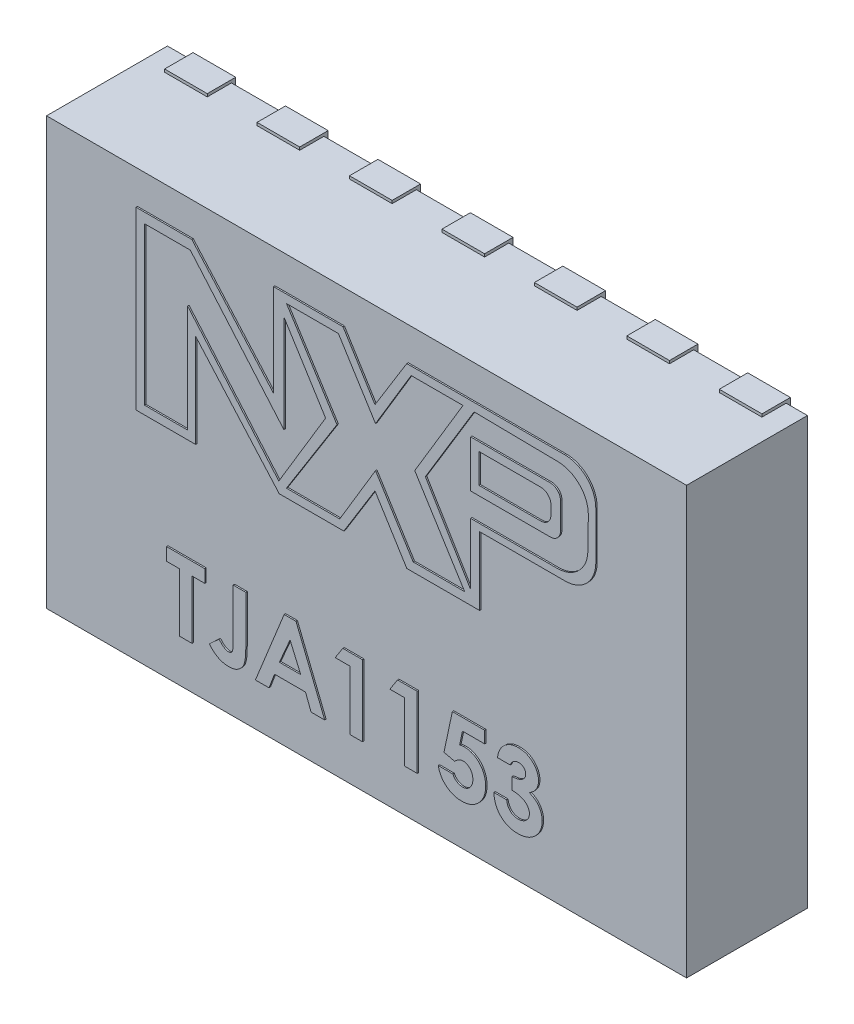
from build123d import *

# Parameters (mm, degrees)
SKETCH1_W           = 4.5
SKETCH1_H           = 3
BOSS_EXTRUDE1_DEPTH = 0.85
SKETCH2_W           = 4.2
SKETCH2_H           = 1.6
SKETCH2_W_2         = 0.3
SKETCH2_H_2         = 0.557287179
BOSS_EXTRUDE2_DEPTH = 0.03
SKETCH3_W           = 5.542428218
SKETCH3_H           = 0.402549931
SKETCH3_W_2         = 5.108551145
SKETCH3_H_2         = 0.537427481
CUT_EXTRUDE1_DEPTH  = 2.03
SKETCH4_W           = 0.3
SKETCH4_H           = 0.2
BOSS_EXTRUDE3_DEPTH = 0.02
BOSS_EXTRUDE4_DEPTH = 0.01
BOSS_EXTRUDE5_DEPTH = 0.01


with BuildPart() as part:
    # Sketch1 → Boss-Extrude1 (new body)
    with BuildSketch(Plane.XY):
        Rectangle(SKETCH1_W, SKETCH1_H)
    extrude(amount=BOSS_EXTRUDE1_DEPTH)

    # Sketch2 → Boss-Extrude2 (add)
    with BuildSketch(Plane(origin=(0, 0, 0), x_dir=(-1, 0, 0), z_dir=(0, 0, -1))):
        Rectangle(SKETCH2_W, SKETCH2_H)
        with Locations((-1.95, 1.37864359)):
            Rectangle(SKETCH2_W_2, SKETCH2_H_2)
        with Locations((-1.3, 1.37864359)):
            Rectangle(SKETCH2_W_2, SKETCH2_H_2)
        with Locations((-0.65, 1.37864359)):
            Rectangle(SKETCH2_W_2, SKETCH2_H_2)
        with Locations((0, 1.37864359)):
            Rectangle(SKETCH2_W_2, SKETCH2_H_2)
        with Locations((0.65, 1.37864359)):
            Rectangle(SKETCH2_W_2, SKETCH2_H_2)
        with Locations((1.3, 1.37864359)):
            Rectangle(SKETCH2_W_2, SKETCH2_H_2)
        with Locations((1.95, 1.37864359)):
            Rectangle(SKETCH2_W_2, SKETCH2_H_2)
        with Locations((1.95, -1.37864359)):
            Rectangle(SKETCH2_W_2, SKETCH2_H_2)
        with Locations((1.3, -1.37864359)):
            Rectangle(SKETCH2_W_2, SKETCH2_H_2)
        with Locations((0.65, -1.37864359)):
            Rectangle(SKETCH2_W_2, SKETCH2_H_2)
        with Locations((0, -1.37864359)):
            Rectangle(SKETCH2_W_2, SKETCH2_H_2)
        with Locations((-0.65, -1.37864359)):
            Rectangle(SKETCH2_W_2, SKETCH2_H_2)
        with Locations((-1.3, -1.37864359)):
            Rectangle(SKETCH2_W_2, SKETCH2_H_2)
        with Locations((-1.95, -1.37864359)):
            Rectangle(SKETCH2_W_2, SKETCH2_H_2)
    extrude(amount=BOSS_EXTRUDE2_DEPTH)

    # Sketch3 → Cut-Extrude1 (cut)
    with BuildSketch(Plane.XY.offset(0.85)):
        with Locations((0.521214109, 1.701274966)):
            Rectangle(SKETCH3_W, SKETCH3_H)
        with Locations((0.304275573, -1.76871374)):
            Rectangle(SKETCH3_W_2, SKETCH3_H_2)
    extrude(amount=-CUT_EXTRUDE1_DEPTH, mode=Mode.SUBTRACT)

    # Sketch4 → Boss-Extrude3 (add)
    with BuildSketch(Plane.XZ.offset(1.5)):
        with Locations((-1.95, 0.07)):
            Rectangle(SKETCH4_W, SKETCH4_H)
        with Locations((-1.3, 0.07)):
            Rectangle(SKETCH4_W, SKETCH4_H)
        with Locations((-0.65, 0.07)):
            Rectangle(SKETCH4_W, SKETCH4_H)
        with Locations((0, 0.07)):
            Rectangle(SKETCH4_W, SKETCH4_H)
        with Locations((0.65, 0.07)):
            Rectangle(SKETCH4_W, SKETCH4_H)
        with Locations((1.3, 0.07)):
            Rectangle(SKETCH4_W, SKETCH4_H)
        with Locations((1.95, 0.07)):
            Rectangle(SKETCH4_W, SKETCH4_H)
    boss_extrude3 = extrude(amount=BOSS_EXTRUDE3_DEPTH)

    # Mirror1: Boss-Extrude3 across plane
    add(boss_extrude3.mirror(Plane.ZX))

    # Sketch8 → Boss-Extrude4 (add)
    # profile 1 of 2: a face of its own
    with BuildSketch(Plane.XY.offset(0.85)):
        with BuildLine():
            Line((-1.218559147, 1.267877009), (-0.644660909, 0.618874845))
            Line((-0.644660909, 0.618874845), (-0.644660909, 1.267877009))
            Line((-0.644660909, 1.267877009), (-0.155544183, 1.267877009))
            Line((-0.155544183, 1.267877009), (0.069183646, 0.905578427))
            Line((0.069183646, 0.905578427), (0.292952543, 1.267877009))
            Line((0.292952543, 1.267877009), (1.405698433, 1.267877009))
            ThreePointArc((1.405698433, 1.267877009), (1.558433498, 1.204612074), (1.621698433, 1.051877009))
            Line((1.621698433, 1.051877009), (1.621698433, 0.716280897))
            ThreePointArc((1.621698433, 0.716280897), (1.558433498, 0.563545832), (1.405698433, 0.500280897))
            Line((1.405698433, 0.500280897), (0.805434822, 0.500280897))
            Line((0.805434822, 0.500280897), (0.805434822, 0.020247185))
            Line((0.805434822, 0.020247185), (0.292952543, 0.020247185))
            Line((0.292952543, 0.020247185), (0.069183646, 0.38099981))
            Line((0.069183646, 0.38099981), (-0.149697341, 0.02661512))
            Line((-0.149697341, 0.02661512), (-0.603870765, 0.02661512))
            Line((-0.603870765, 0.02661512), (-1.192061741, 0.691780461))
            Line((-1.192061741, 0.691780461), (-1.192061741, 0.032897543))
            Line((-1.192061741, 0.032897543), (-1.611137286, 0.032897543))
            Line((-1.611137286, 0.032897543), (-1.611137286, 1.267877009))
            Line((-1.611137286, 1.267877009), (-1.218559147, 1.267877009))
        make_face()
        Polygon((-0.553231932, 1.210312598), (-0.188037013, 1.210312598), (0.073077476, 0.79234991), (0.323648792, 1.210312598), (0.688184293, 1.210312598), (0.348798025, 0.644203119), (0.699760653, 0.08242164), (0.337615575, 0.08242164), (0.073077476, 0.505864459), (-0.178605926, 0.086046767), (-0.553231932, 0.086046767), (-0.198118064, 0.650042618), align=None, mode=Mode.SUBTRACT)
        with BuildLine():
            Line((0.766182701, 1.210312598), (1.356373147, 1.202040737))
            ThreePointArc((1.356373147, 1.202040737), (1.508206605, 1.136641555), (1.569324867, 0.983034882))
            Line((1.569324867, 0.983034882), (1.566236946, 0.762714247))
            ThreePointArc((1.566236946, 0.762714247), (1.501919217, 0.611939743), (1.350258158, 0.549741315))
            Line((1.350258158, 0.549741315), (0.741987684, 0.549741315))
            Line((0.741987684, 0.549741315), (0.741987684, 0.115644305))
            Line((0.741987684, 0.115644305), (0.423296465, 0.644203119))
            Line((0.423296465, 0.644203119), (0.766182701, 1.210312598))
        make_face(mode=Mode.SUBTRACT)
        Polygon((-1.552044791, 0.09243378), (-1.552044791, 1.197500136), (-1.229122452, 1.197500136), (-0.571417002, 0.433439095), (-0.571417002, 1.120265885), (-0.27795521, 0.650042618), (-0.606889936, 0.102651869), (-1.247993344, 0.847426201), (-1.247993344, 0.09243378), align=None, mode=Mode.SUBTRACT)
    # profile 2 of 2: a face of its own
    with BuildSketch(Plane.XY.offset(0.85)):
        with BuildLine():
            Line((0.741987684, 1.046016424), (0.741987684, 0.716280897))
            Line((0.741987684, 0.716280897), (1.301592263, 0.716280897))
            ThreePointArc((1.301592263, 0.716280897), (1.352503951, 0.737369209), (1.373592263, 0.788280897))
            Line((1.373592263, 0.788280897), (1.373592263, 0.974016424))
            ThreePointArc((1.373592263, 0.974016424), (1.352503951, 1.024928112), (1.301592263, 1.046016424))
            Line((1.301592263, 1.046016424), (0.741987684, 1.046016424))
        make_face()
        with BuildLine():
            Line((0.79982972, 0.986259174), (1.234333614, 0.986259174))
            ThreePointArc((1.234333614, 0.986259174), (1.285245302, 0.965170862), (1.306333614, 0.914259174))
            Line((1.306333614, 0.914259174), (1.306333614, 0.851953508))
            ThreePointArc((1.306333614, 0.851953508), (1.285245302, 0.801041819), (1.234333614, 0.779953508))
            Line((1.234333614, 0.779953508), (0.79982972, 0.779953508))
            Line((0.79982972, 0.779953508), (0.79982972, 0.986259174))
        make_face(mode=Mode.SUBTRACT)
    extrude(amount=BOSS_EXTRUDE4_DEPTH)

    # Sketch9 → Boss-Extrude5 (add)
    # profile 1 of 7: a face of its own
    with BuildSketch(Plane.XY.offset(0.85)):
        Polygon((-1.396406206, -0.691089079), (-1.127175436, -0.691089079), (-1.127175436, -0.780832669), (-1.216919026, -0.780832669), (-1.216919026, -1.191089079), (-1.306662616, -1.191089079), (-1.306662616, -0.780832669), (-1.396406206, -0.780832669), align=None)
    # profile 2 of 7: a face of its own
    with BuildSketch(Plane.XY.offset(0.85)):
        with BuildLine():
            Line((-0.928457488, -0.691089079), (-0.838713898, -0.691089079))
            Line((-0.838713898, -0.691089079), (-0.838713898, -1.023020169))
            add(Edge.make_bspline(
                [(-0.838713898, -1.023020169), (-0.838746801, -1.02936427), (-0.838810198, -1.041588099), (-0.839444914, -1.059185902), (-0.840303163, -1.07532046), (-0.841539123, -1.089965922), (-0.843374863, -1.103121579), (-0.845452363, -1.114820253), (-0.847744422, -1.125109613), (-0.851616273, -1.136625008), (-0.857627209, -1.149376998), (-0.866697883, -1.163150959), (-0.877993775, -1.175118184), (-0.891002911, -1.185513103), (-0.905834904, -1.193743912), (-0.922148058, -1.199693163), (-0.939890225, -1.203247286), (-0.952178907, -1.203684499), (-0.958505565, -1.203909592)],
                knots=[0, 0, 0, 0, 1.22248561, 2.355488409, 3.392943897, 4.335991845, 5.186735882, 5.951517034, 6.625683685, 7.215700098, 8.28923535, 9.333114649, 10.380102123, 11.447198135, 12.530158036, 13.633358744, 14.781567393, 16, 16, 16, 16], degree=3))
            add(Edge.make_bspline(
                [(-0.958505565, -1.203909592), (-0.965097367, -1.203705518), (-0.978098975, -1.203303003), (-0.997167172, -1.19987461), (-1.015494092, -1.194377865), (-1.032984924, -1.186430232), (-1.049879294, -1.176474747), (-1.065870588, -1.164125937), (-1.08129268, -1.149766793), (-1.09043499, -1.138747946), (-1.095124154, -1.133096291)],
                knots=[0, 0, 0, 0, 0.990984786, 1.954608977, 2.90473533, 3.862451285, 4.837525908, 5.848096122, 6.896271184, 8, 8, 8, 8], degree=3))
            Line((-1.095124154, -1.133096291), (-1.027215501, -1.07029581))
            add(Edge.make_bspline(
                [(-1.027215501, -1.07029581), (-1.02365988, -1.074316213), (-1.017006358, -1.081839467), (-1.006979697, -1.091649975), (-0.997935108, -1.099531586), (-0.989409055, -1.105216663), (-0.981363223, -1.109224008), (-0.973624501, -1.112110611), (-0.965951661, -1.113744592), (-0.960882749, -1.114027658), (-0.958405404, -1.114166002)],
                knots=[0, 0, 0, 0, 1.529509877, 2.862124173, 3.996688592, 4.944357383, 5.774364335, 6.554177287, 7.293378699, 8, 8, 8, 8], degree=3))
            add(Edge.make_bspline(
                [(-0.958405404, -1.114166002), (-0.956007611, -1.114040961), (-0.951397441, -1.113800548), (-0.945058282, -1.111128054), (-0.939713962, -1.106932126), (-0.936195578, -1.102108362), (-0.933953435, -1.097177177), (-0.932552503, -1.092410428), (-0.931223015, -1.086696388), (-0.93015786, -1.080037921), (-0.929353026, -1.072348176), (-0.928951875, -1.063720506), (-0.928464023, -1.054108289), (-0.928459744, -1.047393321), (-0.928457488, -1.043853502)],
                knots=[0, 0, 0, 0, 1.003927327, 1.930222208, 2.840933547, 3.835773585, 4.407906147, 5.114514582, 5.922289074, 6.876303333, 7.950072246, 9.174518422, 10.510537432, 12, 12, 12, 12], degree=3))
            Line((-0.928457488, -1.043853502), (-0.928457488, -0.691089079))
        make_face()
    # profile 3 of 7: a face of its own
    with BuildSketch(Plane.XY.offset(0.85)):
        Polygon((-0.569382969, -0.691089079), (-0.486149795, -0.691089079), (-0.284226719, -1.191089079), (-0.380080084, -1.191089079), (-0.418942263, -1.088524977), (-0.636790821, -1.088524977), (-0.675653001, -1.191089079), (-0.771406206, -1.191089079), align=None)
        Polygon((-0.527816462, -0.825203663), (-0.602736334, -0.998781387), (-0.45289659, -0.998781387), align=None, mode=Mode.SUBTRACT)
    # profile 4 of 7: a face of its own
    with BuildSketch(Plane.XY.offset(0.85)):
        Polygon((-0.156923033, -0.691089079), (-0.018201078, -0.691089079), (-0.018201078, -1.191089079), (-0.107944667, -1.191089079), (-0.107944667, -0.774422413), (-0.21050877, -0.774422413), align=None)
    # profile 5 of 7: a face of its own
    with BuildSketch(Plane.XY.offset(0.85)):
        Polygon((0.227692352, -0.691089079), (0.366414307, -0.691089079), (0.366414307, -1.191089079), (0.276670717, -1.191089079), (0.276670717, -0.774422413), (0.174106615, -0.774422413), align=None)
    # profile 6 of 7: a face of its own
    with BuildSketch(Plane.XY.offset(0.85)):
        with BuildLine():
            Line((0.613109019, -0.691089079), (0.840773281, -0.691089079))
            Line((0.840773281, -0.691089079), (0.840773281, -0.774422413))
            Line((0.840773281, -0.774422413), (0.684222801, -0.774422413))
            Line((0.684222801, -0.774422413), (0.664691551, -0.868973695))
            add(Edge.make_bspline(
                [(0.664691551, -0.868973695), (0.667352963, -0.868232458), (0.672601815, -0.866770586), (0.680509217, -0.865304514), (0.688172592, -0.864354253), (0.693201252, -0.8642275), (0.69564107, -0.864166002)],
                knots=[0, 0, 0, 0, 1.05461699, 2.079921384, 3.068411212, 4, 4, 4, 4], degree=3))
            add(Edge.make_bspline(
                [(0.69564107, -0.864166002), (0.70095769, -0.86428783), (0.711437918, -0.864527978), (0.726769163, -0.866807769), (0.741449735, -0.870398372), (0.755434711, -0.875519311), (0.768710429, -0.882184346), (0.781292982, -0.89024717), (0.793197813, -0.899721945), (0.804213442, -0.910614601), (0.814335063, -0.922574985), (0.823135234, -0.935511406), (0.830651129, -0.949239402), (0.836629013, -0.963844308), (0.841347268, -0.979234394), (0.844756785, -0.995419522), (0.846773002, -1.012418875), (0.847044877, -1.024016319), (0.847183538, -1.029931227)],
                knots=[0, 0, 0, 0, 1.01440847, 1.999622559, 2.951875003, 3.895578053, 4.836219714, 5.782137149, 6.743708247, 7.735272588, 8.734977101, 9.730283169, 10.717124674, 11.717316708, 12.737475749, 13.78628267, 14.87096371, 16, 16, 16, 16], degree=3))
            add(Edge.make_bspline(
                [(0.847183538, -1.029931227), (0.847014092, -1.035913283), (0.846679725, -1.047717628), (0.844498291, -1.06507419), (0.84064802, -1.081697859), (0.835359287, -1.097633135), (0.82839172, -1.112762897), (0.820012268, -1.12724388), (0.810079255, -1.140968594), (0.79869016, -1.153796346), (0.786308719, -1.165521157), (0.773125408, -1.175835496), (0.759232842, -1.184514929), (0.744630687, -1.191529378), (0.72940272, -1.197079085), (0.713544319, -1.201119007), (0.696978414, -1.203435678), (0.685732316, -1.203749885), (0.68001607, -1.203909592)],
                knots=[0, 0, 0, 0, 1.06808661, 2.107647099, 3.116961351, 4.110378221, 5.100014249, 6.085620622, 7.093190682, 8.119403071, 9.144090782, 10.133780668, 11.103064255, 12.062861538, 13.020824475, 13.992378307, 14.979551724, 16, 16, 16, 16], degree=3))
            add(Edge.make_bspline(
                [(0.68001607, -1.203909592), (0.674904201, -1.203778942), (0.664822525, -1.203521271), (0.64997266, -1.201937495), (0.63565574, -1.199137362), (0.621947774, -1.195084846), (0.608704531, -1.190097124), (0.596079105, -1.183859034), (0.58400212, -1.176489359), (0.572507867, -1.168122596), (0.561783113, -1.158697761), (0.551994695, -1.148380656), (0.543083351, -1.137301321), (0.53523977, -1.125323073), (0.52848854, -1.112463609), (0.522501411, -1.098874479), (0.517600887, -1.08441377), (0.515114012, -1.074388803), (0.513850205, -1.069294208)],
                knots=[0, 0, 0, 0, 1.054957082, 2.080596141, 3.077793124, 4.061112343, 5.027190972, 5.994718051, 6.962465889, 7.943658696, 8.924948258, 9.904494768, 10.875059, 11.855380583, 12.854004648, 13.869083016, 14.917087635, 16, 16, 16, 16], degree=3))
            Line((0.513850205, -1.069294208), (0.616414307, -1.069294208))
            add(Edge.make_bspline(
                [(0.616414307, -1.069294208), (0.618289181, -1.072824555), (0.621932786, -1.079685382), (0.628863726, -1.088794161), (0.636622474, -1.096561736), (0.645139042, -1.103063999), (0.65446861, -1.107935384), (0.664231018, -1.111629616), (0.674548906, -1.113764376), (0.681575843, -1.114031243), (0.685124243, -1.114166002)],
                knots=[0, 0, 0, 0, 1.104910296, 2.147267069, 3.153527244, 4.136738762, 5.099945312, 6.05603338, 7.018353, 8, 8, 8, 8], degree=3))
            add(Edge.make_bspline(
                [(0.685124243, -1.114166002), (0.68759743, -1.11407295), (0.692463468, -1.113889867), (0.699632806, -1.112921312), (0.706476253, -1.111086892), (0.71304469, -1.108546647), (0.719355761, -1.105378674), (0.725318995, -1.101379315), (0.73103814, -1.096775904), (0.73642613, -1.091493475), (0.741306095, -1.085604795), (0.745585291, -1.079277007), (0.749411482, -1.072650715), (0.7522456, -1.065463436), (0.754566503, -1.057929785), (0.75627571, -1.049992932), (0.757297154, -1.041643609), (0.757391713, -1.03594376), (0.757439948, -1.033036195)],
                knots=[0, 0, 0, 0, 0.978869489, 1.925942215, 2.855067702, 3.774946051, 4.70828698, 5.642468714, 6.60995405, 7.609372294, 8.622401667, 9.629904756, 10.629323, 11.642352373, 12.678539694, 13.745912462, 14.850161547, 16, 16, 16, 16], degree=3))
            add(Edge.make_bspline(
                [(0.757439948, -1.033036195), (0.757383965, -1.030196121), (0.757274993, -1.024667849), (0.756373557, -1.016550365), (0.754760903, -1.008848341), (0.752563649, -1.001502787), (0.749750902, -0.994558308), (0.746313536, -0.987973566), (0.742236868, -0.981781846), (0.73749901, -0.976109204), (0.732446607, -0.970906096), (0.727018703, -0.966355499), (0.7212642, -0.962578819), (0.715361913, -0.959281668), (0.709076243, -0.956882074), (0.702548529, -0.955229561), (0.695785637, -0.954017014), (0.691172816, -0.953945773), (0.688830172, -0.953909592)],
                knots=[0, 0, 0, 0, 1.166249705, 2.270133367, 3.348514167, 4.393962215, 5.415026464, 6.420877785, 7.440098956, 8.453121383, 9.451844239, 10.415694839, 11.355045125, 12.27538808, 13.187007209, 14.108269027, 15.039275622, 16, 16, 16, 16], degree=3))
            add(Edge.make_bspline(
                [(0.688830172, -0.953909592), (0.686285518, -0.954006148), (0.681185484, -0.954199666), (0.673608109, -0.95577427), (0.666122097, -0.95832257), (0.658685817, -0.961838353), (0.651373087, -0.966439404), (0.643990921, -0.97183591), (0.636786415, -0.978419978), (0.632205589, -0.983323806), (0.629835781, -0.985860714)],
                knots=[0, 0, 0, 0, 0.88288272, 1.769486374, 2.674910571, 3.623812639, 4.617874466, 5.670434592, 6.794841017, 8, 8, 8, 8], degree=3))
            Line((0.629835781, -0.985860714), (0.554314948, -0.96853299))
            Line((0.554314948, -0.96853299), (0.613109019, -0.691089079))
        make_face()
    # profile 7 of 7: a face of its own
    with BuildSketch(Plane.XY.offset(0.85)):
        with BuildLine():
            Line((1.020260461, -0.812883951), (0.930516871, -0.812883951))
            add(Edge.make_bspline(
                [(0.930516871, -0.812883951), (0.931150495, -0.808397989), (0.932392673, -0.799603558), (0.935365038, -0.786871413), (0.938920307, -0.774794101), (0.943358879, -0.76340987), (0.948564602, -0.752698441), (0.954484539, -0.742623057), (0.961182688, -0.733226963), (0.966316889, -0.727566719), (0.968878249, -0.724742925)],
                knots=[0, 0, 0, 0, 1.111473889, 2.178970933, 3.205615836, 4.199322666, 5.174200091, 6.12565194, 7.064921805, 8, 8, 8, 8], degree=3))
            add(Edge.make_bspline(
                [(0.968878249, -0.724742925), (0.972572672, -0.721017135), (0.97985399, -0.713673994), (0.992021927, -0.704268241), (1.004776172, -0.696128202), (1.018372517, -0.68967472), (1.032599393, -0.684451374), (1.047569936, -0.680942841), (1.063222973, -0.678614898), (1.073904201, -0.678385588), (1.079355012, -0.678268567)],
                knots=[0, 0, 0, 0, 1.01925491, 2.00884431, 2.983262333, 3.955970413, 4.92937149, 5.924503185, 6.940838805, 8, 8, 8, 8], degree=3))
            add(Edge.make_bspline(
                [(1.079355012, -0.678268567), (1.084201064, -0.678382972), (1.093727426, -0.678607871), (1.107728781, -0.680413236), (1.121077901, -0.683579645), (1.13391589, -0.687719654), (1.146053944, -0.693352828), (1.157759961, -0.699891744), (1.168706874, -0.707911997), (1.178920298, -0.716974075), (1.188303275, -0.726775599), (1.196428975, -0.737252623), (1.203414784, -0.74812528), (1.209170168, -0.759483902), (1.213595275, -0.771347709), (1.216666431, -0.783648166), (1.218676577, -0.79635813), (1.21887684, -0.804996922), (1.21897841, -0.809378342)],
                knots=[0, 0, 0, 0, 1.091422571, 2.145516843, 3.172569842, 4.178562979, 5.178154469, 6.181868002, 7.194278174, 8.227918432, 9.254613415, 10.245994977, 11.209837596, 12.161663635, 13.10878368, 14.055455738, 15.013766427, 16, 16, 16, 16], degree=3))
            add(Edge.make_bspline(
                [(1.21897841, -0.809378342), (1.218769983, -0.814804367), (1.218359656, -0.825486541), (1.214992621, -0.841120696), (1.209722295, -0.856069739), (1.202108797, -0.870124509), (1.192589986, -0.883246757), (1.180910723, -0.894997768), (1.167403665, -0.905561781), (1.157263737, -0.911238883), (1.152071358, -0.91414597)],
                knots=[0, 0, 0, 0, 0.992805628, 1.954529043, 2.915727527, 3.886831945, 4.871318353, 5.87440735, 6.911542536, 8, 8, 8, 8], degree=3))
            add(Edge.make_bspline(
                [(1.152071358, -0.91414597), (1.155635327, -0.915316096), (1.162638366, -0.917615341), (1.172592343, -0.922143679), (1.182057439, -0.9270924), (1.190870666, -0.932841511), (1.199119684, -0.939158541), (1.206754205, -0.946097491), (1.213819844, -0.953643232), (1.220201257, -0.961837261), (1.22586501, -0.970548531), (1.230946795, -0.979575817), (1.235129386, -0.98905602), (1.238672562, -0.998880868), (1.241370135, -1.009138664), (1.243269467, -1.019789658), (1.244367327, -1.030809554), (1.24453477, -1.038275528), (1.244619435, -1.042050618)],
                knots=[0, 0, 0, 0, 1.059543567, 2.081955587, 3.086750234, 4.076226789, 5.052108497, 6.020845489, 6.989030705, 7.970690546, 8.952259656, 9.923888338, 10.895517021, 11.877585046, 12.873342345, 13.889638361, 14.932918083, 16, 16, 16, 16], degree=3))
            add(Edge.make_bspline(
                [(1.244619435, -1.042050618), (1.244447807, -1.047598467), (1.244109391, -1.058537697), (1.241957899, -1.074650063), (1.23795221, -1.090011772), (1.232682504, -1.104799584), (1.225653288, -1.118822594), (1.217381082, -1.132402611), (1.207212879, -1.145068684), (1.195912668, -1.15715567), (1.183363124, -1.168144617), (1.169757378, -1.177671539), (1.155394606, -1.185847333), (1.140183941, -1.192484676), (1.124130667, -1.197596189), (1.107270564, -1.201291027), (1.089532793, -1.203551589), (1.077425376, -1.203788566), (1.071242031, -1.203909592)],
                knots=[0, 0, 0, 0, 1.005138573, 1.981928558, 2.936866704, 3.876260664, 4.820238198, 5.773547, 6.751179199, 7.756627054, 8.768222608, 9.766606018, 10.760583154, 11.757261445, 12.767156078, 13.807575856, 14.880313354, 16, 16, 16, 16], degree=3))
            add(Edge.make_bspline(
                [(1.071242031, -1.203909592), (1.065392688, -1.203781991), (1.05395507, -1.203532483), (1.03722516, -1.201372869), (1.021324964, -1.197889235), (1.006213905, -1.192978765), (0.991950445, -1.186610725), (0.97840524, -1.179027817), (0.965848579, -1.169792678), (0.954140557, -1.1593222), (0.943540894, -1.147574917), (0.934067291, -1.134822951), (0.925928644, -1.12101781), (0.919091575, -1.106218476), (0.913609534, -1.090398987), (0.909285317, -1.073591511), (0.90626478, -1.055763214), (0.905344869, -1.043496965), (0.904875846, -1.037242925)],
                knots=[0, 0, 0, 0, 1.066544725, 2.085487077, 3.070979577, 4.031932826, 4.977951092, 5.916076795, 6.857635327, 7.814973522, 8.776389752, 9.738577119, 10.707772778, 11.69409279, 12.707140348, 13.757286496, 14.856535458, 16, 16, 16, 16], degree=3))
            Line((0.904875846, -1.037242925), (0.994619435, -1.037242925))
            add(Edge.make_bspline(
                [(0.994619435, -1.037242925), (0.995188131, -1.040387539), (0.996295815, -1.046512498), (0.998456285, -1.055380077), (1.001271679, -1.063565401), (1.004526975, -1.071141219), (1.008043184, -1.078207001), (1.012291606, -1.084501788), (1.016960938, -1.090196511), (1.023698819, -1.09696646), (1.033331083, -1.1039223), (1.046337831, -1.109967257), (1.060806606, -1.113510344), (1.070921723, -1.113942589), (1.076149884, -1.114166002)],
                knots=[0, 0, 0, 0, 0.928156231, 1.807827665, 2.648129825, 3.438902246, 4.202261636, 4.936546065, 5.639352463, 6.338805438, 7.70633318, 9.064371875, 10.482673459, 12, 12, 12, 12], degree=3))
            add(Edge.make_bspline(
                [(1.076149884, -1.114166002), (1.078924131, -1.114118429), (1.08435826, -1.114025242), (1.092340186, -1.112992397), (1.099944094, -1.1112913), (1.107184148, -1.108979573), (1.114106437, -1.106081678), (1.120578705, -1.102345016), (1.126732872, -1.098000613), (1.132502037, -1.09311635), (1.137832865, -1.087794253), (1.142268427, -1.081900934), (1.146322209, -1.075912268), (1.149320416, -1.069436457), (1.151947491, -1.062821967), (1.153555395, -1.055828714), (1.154769478, -1.048603397), (1.154840036, -1.043658708), (1.154875846, -1.041149175)],
                knots=[0, 0, 0, 0, 1.110435564, 2.175094844, 3.216326037, 4.226890168, 5.215276772, 6.21526065, 7.213097102, 8.228249917, 9.239874822, 10.221364777, 11.178138315, 12.128914389, 13.072518965, 14.022636769, 14.996447288, 16, 16, 16, 16], degree=3))
            add(Edge.make_bspline(
                [(1.154875846, -1.041149175), (1.154780778, -1.038404574), (1.154591521, -1.032940703), (1.153045268, -1.024967331), (1.150603407, -1.01729759), (1.147211365, -1.009965444), (1.14268167, -1.00299792), (1.137336681, -0.996255227), (1.130755301, -0.99008831), (1.123534645, -0.983992499), (1.115161521, -0.978678791), (1.106043712, -0.973775019), (1.095941587, -0.969873131), (1.085101749, -0.966388021), (1.073319151, -0.963842552), (1.060666959, -0.961994293), (1.047165584, -0.96061855), (1.03785891, -0.960421177), (1.033080974, -0.960319849)],
                knots=[0, 0, 0, 0, 0.809814727, 1.612155564, 2.388397, 3.182215007, 3.988903953, 4.837162975, 5.715530372, 6.646997145, 7.623086902, 8.637258368, 9.698941581, 10.815059213, 11.996518529, 13.252603015, 14.589518788, 16, 16, 16, 16], degree=3))
            Line((1.033080974, -0.960319849), (1.033080974, -0.876986515))
            add(Edge.make_bspline(
                [(1.033080974, -0.876986515), (1.039029789, -0.876479895), (1.050158844, -0.875532109), (1.065606569, -0.873315679), (1.078611562, -0.870353055), (1.089486398, -0.866778809), (1.098516166, -0.862188547), (1.106404521, -0.8571211), (1.113198345, -0.851236), (1.118940038, -0.844708742), (1.123533214, -0.837699078), (1.126783996, -0.830315961), (1.128930643, -0.822787832), (1.129134038, -0.817638818), (1.12923482, -0.815087477)],
                knots=[0, 0, 0, 0, 1.70044513, 3.18119609, 4.440695891, 5.496282586, 6.431922213, 7.318171381, 8.16090191, 8.983045123, 9.787564368, 10.536848927, 11.275007137, 12, 12, 12, 12], degree=3))
            add(Edge.make_bspline(
                [(1.12923482, -0.815087477), (1.129060942, -0.811832242), (1.128721568, -0.805478713), (1.12608581, -0.796385475), (1.121510433, -0.788279607), (1.115375655, -0.781178166), (1.107900214, -0.77524651), (1.099137688, -0.770940229), (1.089278223, -0.768410097), (1.082341558, -0.768147807), (1.078754051, -0.768012156)],
                knots=[0, 0, 0, 0, 1.009664648, 1.970651636, 2.907870547, 3.878035693, 4.867062054, 5.849714035, 6.887914197, 8, 8, 8, 8], degree=3))
            add(Edge.make_bspline(
                [(1.078754051, -0.768012156), (1.075502379, -0.76817221), (1.069050065, -0.768489806), (1.059614852, -0.770860258), (1.050654543, -0.774850619), (1.042354681, -0.780353092), (1.034835076, -0.786961328), (1.028663649, -0.794787412), (1.02353055, -0.80336247), (1.021354764, -0.809697682), (1.020260461, -0.812883951)],
                knots=[0, 0, 0, 0, 0.98818071, 1.960853194, 2.938124878, 3.957524365, 4.978590984, 5.968022688, 6.978025184, 8, 8, 8, 8], degree=3))
        make_face()
    extrude(amount=BOSS_EXTRUDE5_DEPTH)


solid = part.part
